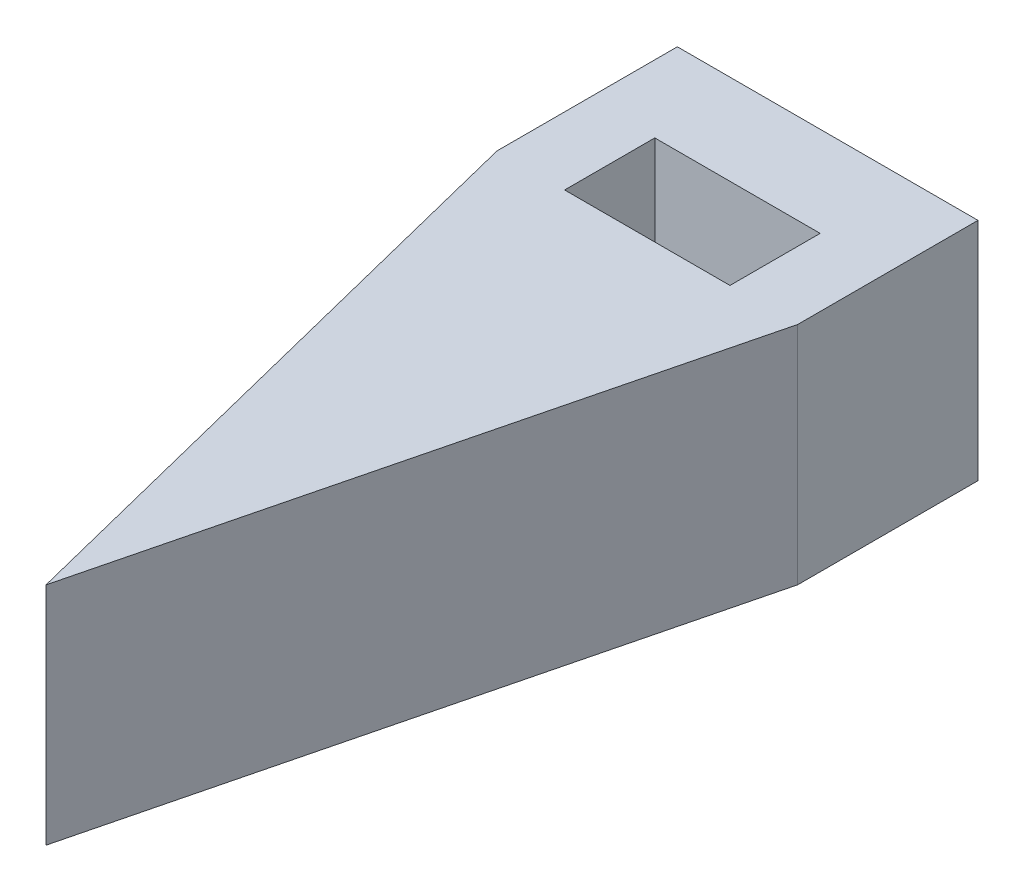
from build123d import *

# Parameters (mm, degrees)
SKETCH2_W  = 5.5
SKETCH2_H  = 3
BODY_DEPTH = 3.75


with BuildPart() as part:
    # Sketch2 → Body (new, symmetric)
    with BuildSketch(Plane(origin=(0, 0, 0), x_dir=(1, 0, 0), z_dir=(0, 1, 0))):
        Polygon((-5, -6), (0, -26), (5, -6), (5, 0), (-5, 0), align=None)
        with Locations((0, -4.5)):
            Rectangle(SKETCH2_W, SKETCH2_H, mode=Mode.SUBTRACT)
    extrude(amount=BODY_DEPTH, both=True)


solid = part.part
